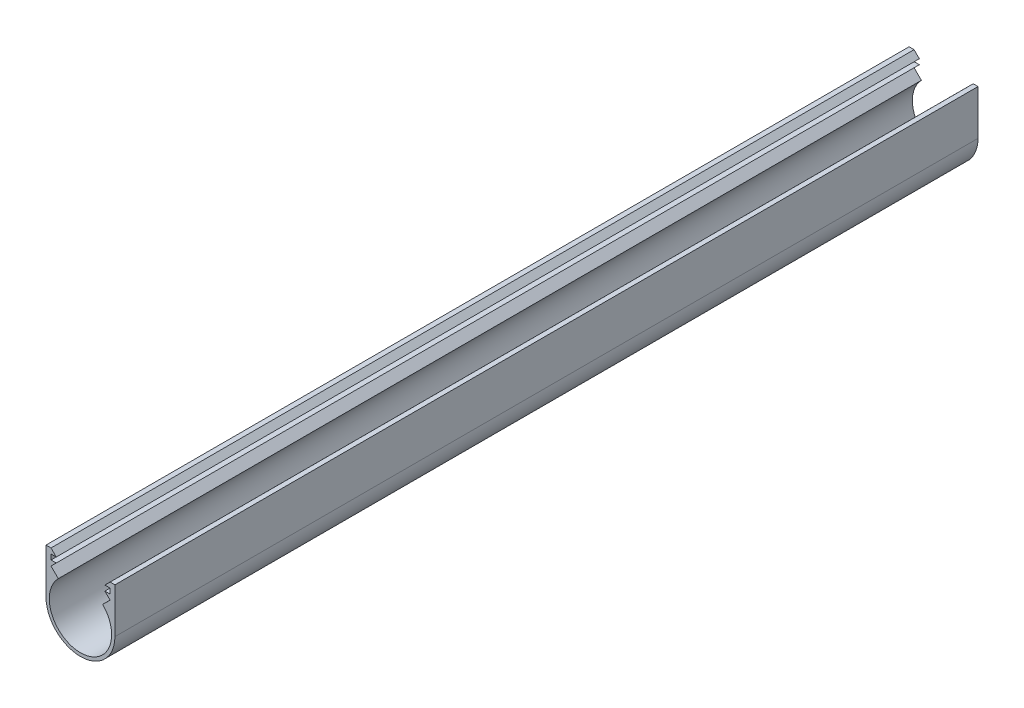
from build123d import *

# Parameters (mm, degrees)
SKETCH1_R           = 10.5
SKETCH1_R_2         = 9.5
BOSS_EXTRUDE1_DEPTH = 263
BOSS_EXTRUDE2_DEPTH = 263
CUT_EXTRUDE1_DEPTH  = 264.564518904


with BuildPart() as part:
    # Sketch1 → Boss-Extrude1 (new body)
    # profile 1 of 3: a face of its own
    with BuildSketch(Plane.XY):
        with BuildLine():
            ThreePointArc((-10.5, 0), (-7.424621202, 7.424621202), (0, 10.5))
            Line((0, 10.5), (-10.5, 10.5))
            Line((-10.5, 10.5), (-10.5, 0))
        make_face()
    # profile 2 of 3: a face of its own
    with BuildSketch(Plane.XY):
        with BuildLine():
            Line((10.5, 10.5), (0, 10.5))
            ThreePointArc((0, 10.5), (7.424621202, 7.424621202), (10.5, 0))
            Line((10.5, 0), (10.5, 10.5))
        make_face()
    # profile 3 of 3: a face of its own
    with BuildSketch(Plane.XY):
        Circle(SKETCH1_R)
        Circle(SKETCH1_R_2, mode=Mode.SUBTRACT)
    extrude(amount=BOSS_EXTRUDE1_DEPTH)

    # Sketch2 → Boss-Extrude2 (add)
    with BuildSketch(Plane.XY.offset(263)):
        Polygon((-10.5, 13.675), (-10.5, 10.5), (-8.976, 10.5), (-8.976, 12.0748), (-8.976, 13.675), align=None)
        Polygon((-8.976, 13.675), (-8.976, 12.0748), (-7.3758, 12.0748), align=None)
        Polygon((7.4324, 12.086261455), (9.0326, 12.0875), (9.0326, 13.675), align=None)
        Polygon((9.0326, 12.0875), (9.0326, 10.5), (10.5, 10.5), (10.5, 13.675), (9.0326, 13.675), align=None)
    extrude(amount=-BOSS_EXTRUDE2_DEPTH)

    # Sketch3 → Cut-Extrude1 (cut, through all)
    with BuildSketch(Plane.XY.offset(263)):
        with BuildLine():
            ThreePointArc((-6.74608819, 6.688818591), (-5.154578199, 7.979995212), (-3.323185213, 8.8998))
            Line((-3.323185213, 8.8998), (-8.976, 8.8998))
            Line((-8.976, 8.8998), (-6.74608819, 6.688818591))
        make_face()
        with BuildLine():
            Line((3.323185213, 8.8998), (9.0326, 8.8998))
            Line((9.0326, 8.8998), (7.4324, 10.5))
            Line((7.4324, 10.5), (-7.3758, 10.5))
            Line((-7.3758, 10.5), (-8.976, 8.8998))
            Line((-8.976, 8.8998), (-3.323185213, 8.8998))
            ThreePointArc((-3.323185213, 8.8998), (0, 9.5), (3.323185213, 8.8998))
        make_face()
        with BuildLine():
            Line((6.767076018, 6.667584433), (9.0326, 8.8998))
            Line((9.0326, 8.8998), (3.323185213, 8.8998))
            ThreePointArc((3.323185213, 8.8998), (5.167111332, 7.971885629), (6.767076018, 6.667584433))
        make_face()
    extrude(amount=-CUT_EXTRUDE1_DEPTH, mode=Mode.SUBTRACT)


solid = part.part
